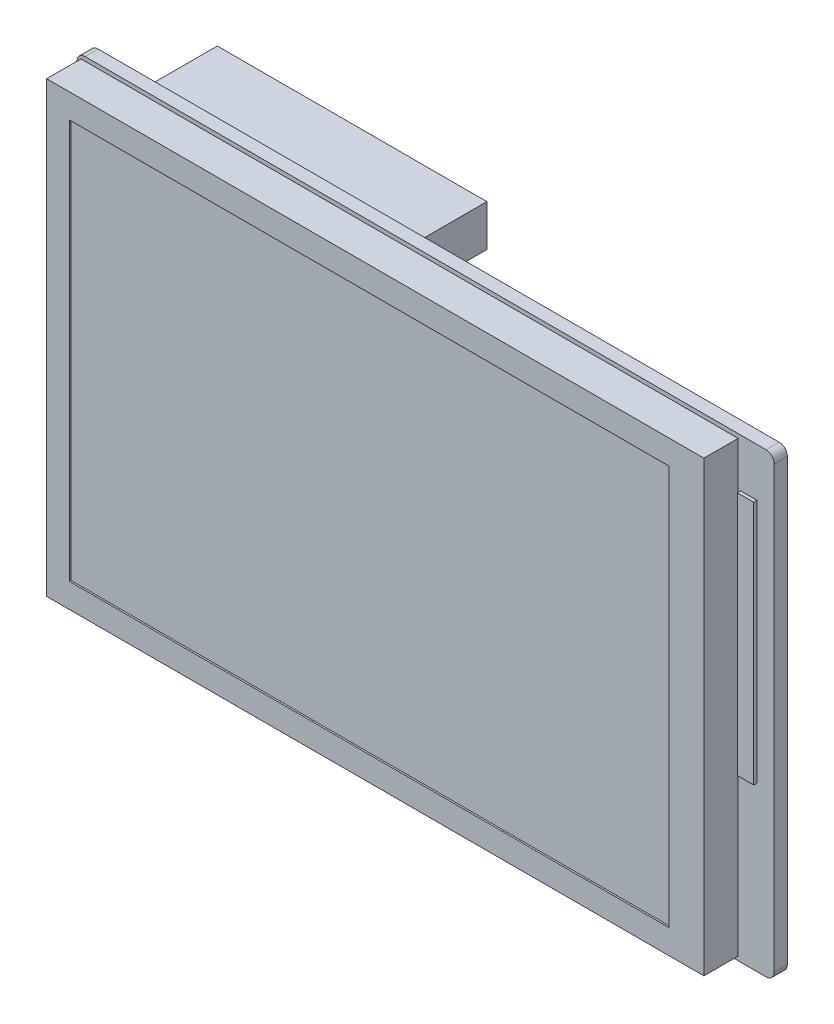
from build123d import *

# Parameters (mm, degrees)
PCB_DEPTH                       = 1.6
SKETCH2_W                       = 2
SKETCH2_H                       = 30
BODY00_DEPTH                    = 0.4
SKETCH3_W                       = 80.5
SKETCH3_H                       = 54.92
BODY01_DEPTH                    = 4.2
SKETCH4_W                       = 6
SKETCH4_H                       = 12
UNDER00_DEPTH                   = 5
SKETCH5_W                       = 15
SKETCH5_H                       = 11.5
UNDER01_DEPTH                   = 5.6
SKETCH6_W                       = 33.02
SKETCH6_H                       = 5.08
UNDER02_DEPTH                   = 8.5
SKETCH7_R                       = 2.5
SIDE0_AUDIO_JACK_NOSE_DEPTH     = 2.5
SKETCH8_R                       = 1.75
SIDEBORE0_AUDIO_JACK_NOSE_DEPTH = 2.5
SKETCH9_W                       = 14
SKETCH9_H                       = 4.5
CUT00_DEPTH                     = 11
SKETCH10_W                      = 1
SKETCH10_H                      = 1
CUT01_DEPTH                     = 8.5
SKETCH11_W                      = 73.44
SKETCH11_H                      = 48.96
CUT02_DEPTH                     = 0.2
SKETCH12_R                      = 1.375
HOLES_DEPTH                     = 1.6


with BuildPart() as part:
    # Sketch1 → PCB (new body)
    with BuildSketch(Plane.XY):
        with BuildLine():
            Line((1, 0), (84.42, 0))
            ThreePointArc((84.42, 0), (85.127106781, 0.292893219), (85.42, 1))
            Line((85.42, 1), (85.42, 54.92))
            ThreePointArc((85.42, 54.92), (85.127106781, 55.627106781), (84.42, 55.92))
            Line((84.42, 55.92), (1, 55.92))
            ThreePointArc((1, 55.92), (0.292893219, 55.627106781), (0, 54.92))
            Line((0, 54.92), (0, 1))
            ThreePointArc((0, 1), (0.292893219, 0.292893219), (1, 0))
        make_face()
    extrude(amount=PCB_DEPTH)

    # Sketch2 → Body00 (add)
    with BuildSketch(Plane.XY.offset(1.6)):
        with Locations((82.3, 35)):
            Rectangle(SKETCH2_W, SKETCH2_H)
    extrude(amount=BODY00_DEPTH)

    # Sketch3 → Body01 (add)
    with BuildSketch(Plane.XY.offset(1.6)):
        with Locations((40.75, 27.96)):
            Rectangle(SKETCH3_W, SKETCH3_H)
    extrude(amount=BODY01_DEPTH)

    # Sketch4 → Under00 (add)
    with BuildSketch(Plane.XY):
        with Locations((53.5, 6)):
            Rectangle(SKETCH4_W, SKETCH4_H)
    extrude(amount=-UNDER00_DEPTH)

    # Sketch5 → Under01 (add)
    with BuildSketch(Plane.XY):
        with Locations((32, 5.25)):
            Rectangle(SKETCH5_W, SKETCH5_H)
    extrude(amount=-UNDER01_DEPTH)

    # Sketch6 → Under02 (add)
    with BuildSketch(Plane.XY):
        with Locations((23.61, 52.5)):
            Rectangle(SKETCH6_W, SKETCH6_H)
    extrude(amount=-UNDER02_DEPTH)

    # Sketch7 → Side0_Audio_jack_nose (add)
    with BuildSketch(Plane(origin=(0, 0, 0), x_dir=(1, 0, 0), z_dir=(0, 1, 0))):
        with Locations(Location((53.5, 2.5, 0), (0, 0, 270))):
            Circle(SKETCH7_R)
    extrude(amount=-SIDE0_AUDIO_JACK_NOSE_DEPTH)

    # Sketch8 → SideBore0_Audio_jack_nose (cut)
    with BuildSketch(Plane(origin=(0, 0, 0), x_dir=(1, 0, 0), z_dir=(0, 1, 0))):
        with Locations(Location((53.5, 2.5, 0), (0, 0, 270))):
            Circle(SKETCH8_R)
    extrude(amount=-SIDEBORE0_AUDIO_JACK_NOSE_DEPTH, mode=Mode.SUBTRACT)

    # Sketch9 → Cut00 (cut)
    with BuildSketch(Plane(origin=(0, 10.5, 0), x_dir=(1, 0, 0), z_dir=(0, 1, 0))):
        with Locations((32, 2.8)):
            Rectangle(SKETCH9_W, SKETCH9_H)
    extrude(amount=-CUT00_DEPTH, mode=Mode.SUBTRACT)

    # Sketch10 → Cut01 (cut)
    with BuildSketch(Plane.XY):
        with Locations((8.37, 51.23)):
            Rectangle(SKETCH10_W, SKETCH10_H)
        with Locations((8.37, 53.77)):
            Rectangle(SKETCH10_W, SKETCH10_H)
        with Locations((10.91, 51.23)):
            Rectangle(SKETCH10_W, SKETCH10_H)
        with Locations((10.91, 53.77)):
            Rectangle(SKETCH10_W, SKETCH10_H)
        with Locations((13.45, 51.23)):
            Rectangle(SKETCH10_W, SKETCH10_H)
        with Locations((13.45, 53.77)):
            Rectangle(SKETCH10_W, SKETCH10_H)
        with Locations((15.99, 51.23)):
            Rectangle(SKETCH10_W, SKETCH10_H)
        with Locations((15.99, 53.77)):
            Rectangle(SKETCH10_W, SKETCH10_H)
        with Locations((18.53, 51.23)):
            Rectangle(SKETCH10_W, SKETCH10_H)
        with Locations((18.53, 53.77)):
            Rectangle(SKETCH10_W, SKETCH10_H)
        with Locations((21.07, 51.23)):
            Rectangle(SKETCH10_W, SKETCH10_H)
        with Locations((21.07, 53.77)):
            Rectangle(SKETCH10_W, SKETCH10_H)
        with Locations((23.61, 51.23)):
            Rectangle(SKETCH10_W, SKETCH10_H)
        with Locations((23.61, 53.77)):
            Rectangle(SKETCH10_W, SKETCH10_H)
        with Locations((26.15, 51.23)):
            Rectangle(SKETCH10_W, SKETCH10_H)
        with Locations((26.15, 53.77)):
            Rectangle(SKETCH10_W, SKETCH10_H)
        with Locations((28.69, 51.23)):
            Rectangle(SKETCH10_W, SKETCH10_H)
        with Locations((28.69, 53.77)):
            Rectangle(SKETCH10_W, SKETCH10_H)
        with Locations((31.23, 51.23)):
            Rectangle(SKETCH10_W, SKETCH10_H)
        with Locations((31.23, 53.77)):
            Rectangle(SKETCH10_W, SKETCH10_H)
        with Locations((33.77, 51.23)):
            Rectangle(SKETCH10_W, SKETCH10_H)
        with Locations((33.77, 53.77)):
            Rectangle(SKETCH10_W, SKETCH10_H)
        with Locations((36.31, 51.23)):
            Rectangle(SKETCH10_W, SKETCH10_H)
        with Locations((36.31, 53.77)):
            Rectangle(SKETCH10_W, SKETCH10_H)
        with Locations((38.85, 51.23)):
            Rectangle(SKETCH10_W, SKETCH10_H)
        with Locations((38.85, 53.77)):
            Rectangle(SKETCH10_W, SKETCH10_H)
    extrude(amount=-CUT01_DEPTH, mode=Mode.SUBTRACT)

    # Sketch11 → Cut02 (cut)
    with BuildSketch(Plane.XY.offset(5.8)):
        with Locations((40, 27.96)):
            Rectangle(SKETCH11_W, SKETCH11_H)
    extrude(amount=-CUT02_DEPTH, mode=Mode.SUBTRACT)

    # Sketch12 → Holes (cut)
    with BuildSketch(Plane.XY.offset(1.6)):
        with Locations((3.5, 3.5)):
            Circle(SKETCH12_R)
        with Locations((3.5, 52.5)):
            Circle(SKETCH12_R)
        with Locations((61.5, 3.5)):
            Circle(SKETCH12_R)
        with Locations((61.5, 52.5)):
            Circle(SKETCH12_R)
    extrude(amount=-HOLES_DEPTH, mode=Mode.SUBTRACT)


solid = part.part
